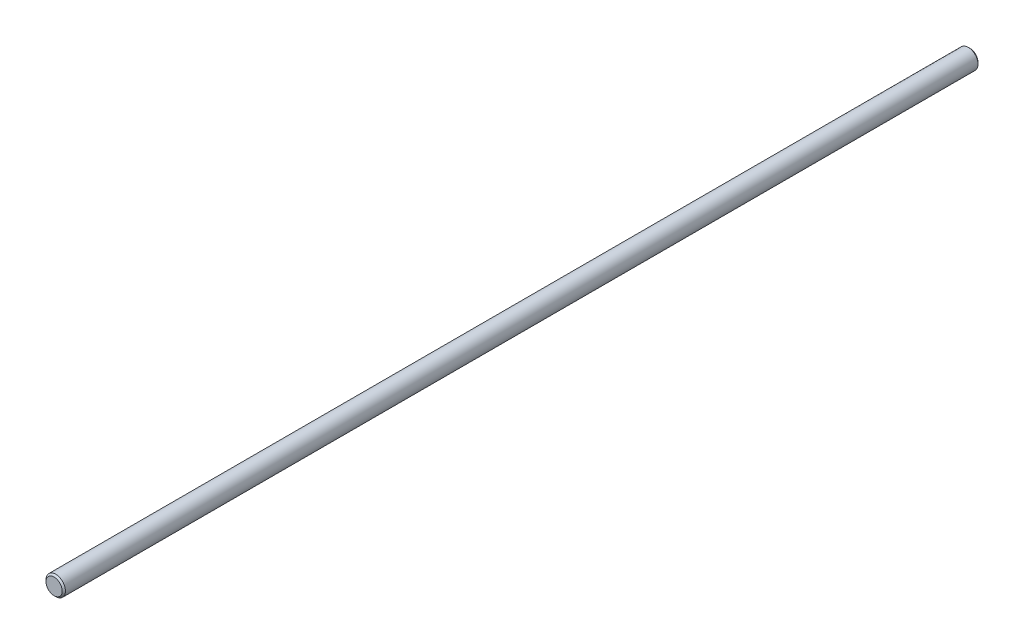
from build123d import *

# Parameters (mm, degrees)
SKETCH1_R           = 3
BOSS_EXTRUDE1_DEPTH = 282.5
CHAMFER1_SIZE       = 0.5


with BuildPart() as part:
    # Sketch1 → Boss-Extrude1 (new body)
    with BuildSketch(Plane.XY):
        Circle(SKETCH1_R)
    extrude(amount=-BOSS_EXTRUDE1_DEPTH)

    # Chamfer1
    chamfer1_edges = [part.edges().sort_by_distance(p)[0] for p in [
        (-3, 0, 0),
        (-3, 0, -282.5),
    ]]
    chamfer(chamfer1_edges, length=CHAMFER1_SIZE)


solid = part.part
